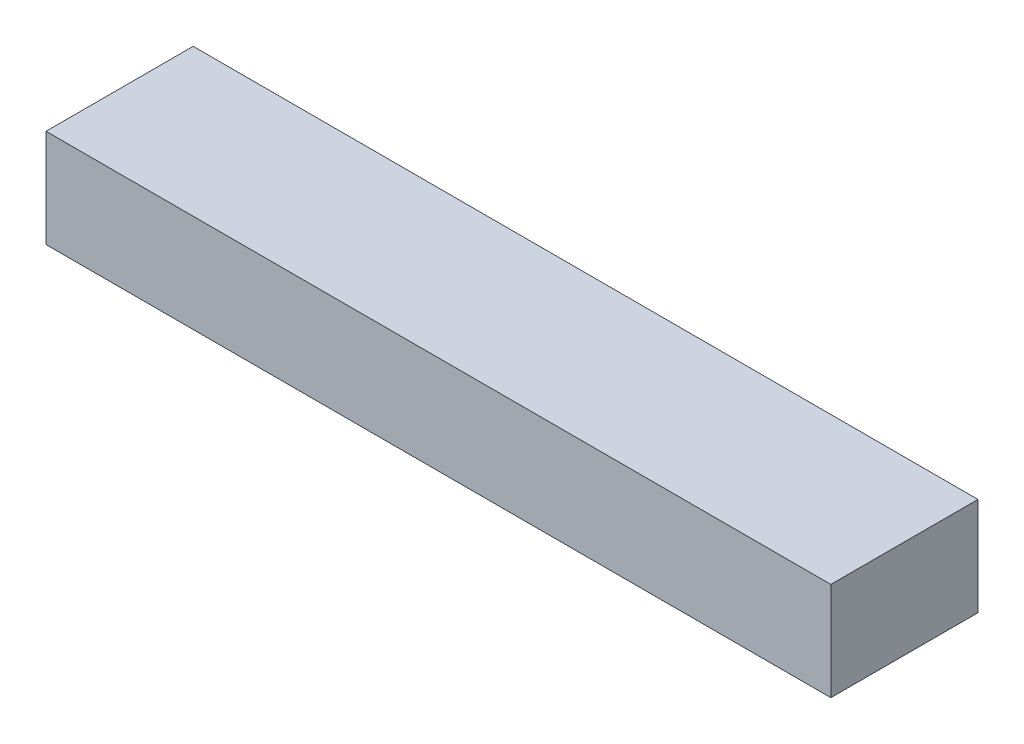
from build123d import *

# Parameters (mm, degrees)
SKETCH1_W           = 406.4
SKETCH1_H           = 76.2
BOSS_EXTRUDE1_DEPTH = 50.8


with BuildPart() as part:
    # Sketch1 → Boss-Extrude1 (new body)
    with BuildSketch(Plane(origin=(0, 0, 0), x_dir=(1, 0, 0), z_dir=(0, 1, 0))):
        Rectangle(SKETCH1_W, SKETCH1_H)
    extrude(amount=BOSS_EXTRUDE1_DEPTH)


solid = part.part
